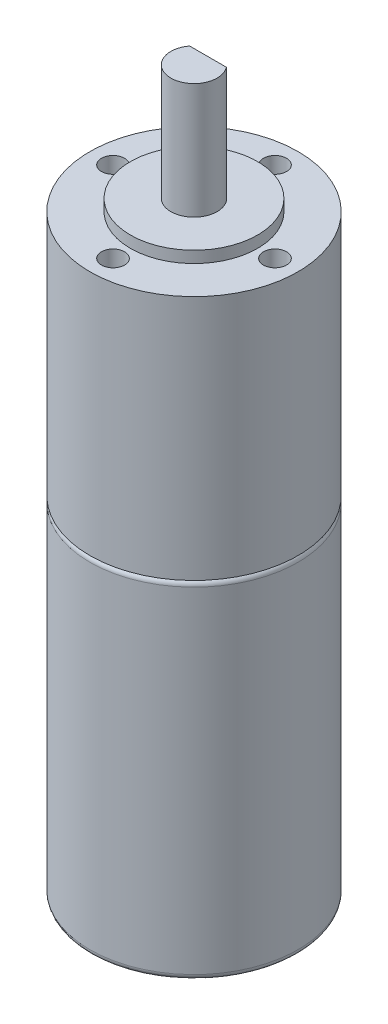
from build123d import *

# Parameters (mm, degrees)
SKETCH_1_R          = 18
EXTRUDE_1_DEPTH     = 60
FILLET_1_R          = 1
SKETCH_3_R          = 18
EXTRUDE_2_DEPTH     = 42.5
SKETCH_4_R          = 11
EXTRUDE_3_DEPTH     = 2
SKETCH_5_R          = 4
EXTRUDE_4_DEPTH     = 20
CUT_EXTRUDE_START   = -15
CUT_EXTRUDE_1_DEPTH = 15
SKETCH_7_R          = 2
CUT_EXTRUDE_2_DEPTH = 5


with BuildPart() as part:
    # 草图1 → 凸台-拉伸1 (new body)
    with BuildSketch(Plane(origin=(0, 0, 0), x_dir=(1, 0, 0), z_dir=(0, 1, 0))):
        with Locations(Location((0, 0, 0), (0, 0, 270))):
            Circle(SKETCH_1_R)
    extrude(amount=EXTRUDE_1_DEPTH)

    # 圆角1
    fillet_1_edges = [part.edges().sort_by_distance(p)[0] for p in [
        (0, 0, -18),
        (0, 60, -18),
    ]]
    fillet(fillet_1_edges, radius=FILLET_1_R)

    # 草图3 → 凸台-拉伸2 (add)
    with BuildSketch(Plane(origin=(0, 60, 0), x_dir=(1, 0, 0), z_dir=(0, 1, 0))):
        with Locations(Location((0, 0, 0), (0, 0, 270))):
            Circle(SKETCH_3_R)
    extrude(amount=EXTRUDE_2_DEPTH)

    # 草图4 → 凸台-拉伸3 (add)
    with BuildSketch(Plane(origin=(0, 102.5, 0), x_dir=(1, 0, 0), z_dir=(0, 1, 0))):
        with Locations(Location((0, 0, 0), (0, 0, 270))):
            Circle(SKETCH_4_R)
    extrude(amount=EXTRUDE_3_DEPTH)

    # 草图5 → 凸台-拉伸4 (add)
    with BuildSketch(Plane(origin=(0, 104.5, 0), x_dir=(1, 0, 0), z_dir=(0, 1, 0))):
        with Locations(Location((0, 0, 0), (0, 0, 270))):
            Circle(SKETCH_5_R)
    extrude(amount=EXTRUDE_4_DEPTH)

    # 草图6 → 切除-拉伸1 (cut)
    with BuildSketch(Plane(origin=(0, 124.5, 0), x_dir=(1, 0, 0), z_dir=(0, 1, 0)).offset(CUT_EXTRUDE_START)):
        with BuildLine():
            Line((-3.180068641, 2.426347758), (3.180068641, 2.426347758))
            ThreePointArc((3.180068641, 2.426347758), (0, 4), (-3.180068641, 2.426347758))
        make_face()
    extrude(amount=CUT_EXTRUDE_1_DEPTH, mode=Mode.SUBTRACT)

    # 草图7 → 切除-拉伸2 (cut)
    with BuildSketch(Plane(origin=(0, 102.5, 0), x_dir=(1, 0, 0), z_dir=(0, 1, 0))):
        with Locations(Location((0, 14, 0), (0, 0, 270))):
            Circle(SKETCH_7_R)
        with Locations(Location((14, 0, 0), (0, 0, 270))):
            Circle(SKETCH_7_R)
        with Locations(Location((0, -14, 0), (0, 0, 270))):
            Circle(SKETCH_7_R)
        with Locations(Location((-14, 0, 0), (0, 0, 270))):
            Circle(SKETCH_7_R)
    extrude(amount=-CUT_EXTRUDE_2_DEPTH, mode=Mode.SUBTRACT)


solid = part.part
